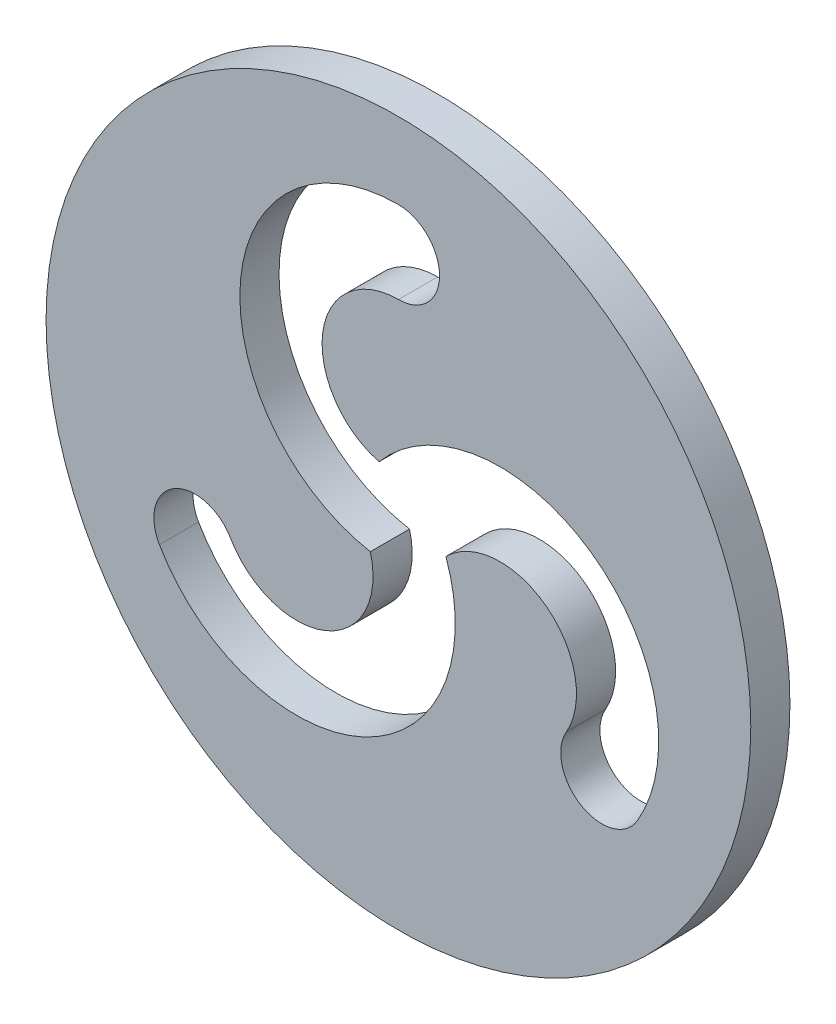
from build123d import *

# Parameters (mm, degrees)
CROQUIS1_R            = 45
DISCO_DEPTH           = 5
CORTAR_EXTRUIR6_DEPTH = 5


with BuildPart() as part:
    # Croquis1 → Disco (new body)
    with BuildSketch(Plane.XY):
        Circle(CROQUIS1_R)
    extrude(amount=DISCO_DEPTH)

    # Croquis6 → Cortar-Extruir6 (cut)
    with BuildSketch(Plane.XY.offset(5)):
        with BuildLine():
            ThreePointArc((-30.527395483, -17.625), (-4.464035413, -25.86746934), (6.062177826, -0.639788633))
            ThreePointArc((6.062177826, -0.639788633), (18.906715666, 0.249805468), (21.434128744, -12.375))
            ThreePointArc((21.434128744, -12.375), (23.355762114, -19.54663337), (30.527395483, -17.625))
            ThreePointArc((30.527395483, -17.625), (24.633903286, 9.067766599), (-2.477015704, 5.569894316))
            ThreePointArc((-2.477015704, 5.569894316), (-9.669695714, 16.248793335), (0, 24.75))
            ThreePointArc((0, 24.75), (5.25, 30), (0, 35.25))
            ThreePointArc((0, 35.25), (-20.169867874, 16.799702741), (-3.585162122, -4.930105684))
            ThreePointArc((-3.585162122, -4.930105684), (-9.237019952, -16.498598803), (-21.434128744, -12.375))
            ThreePointArc((-21.434128744, -12.375), (-28.605762114, -10.45336663), (-30.527395483, -17.625))
        make_face()
    extrude(amount=-CORTAR_EXTRUIR6_DEPTH, mode=Mode.SUBTRACT)


solid = part.part
